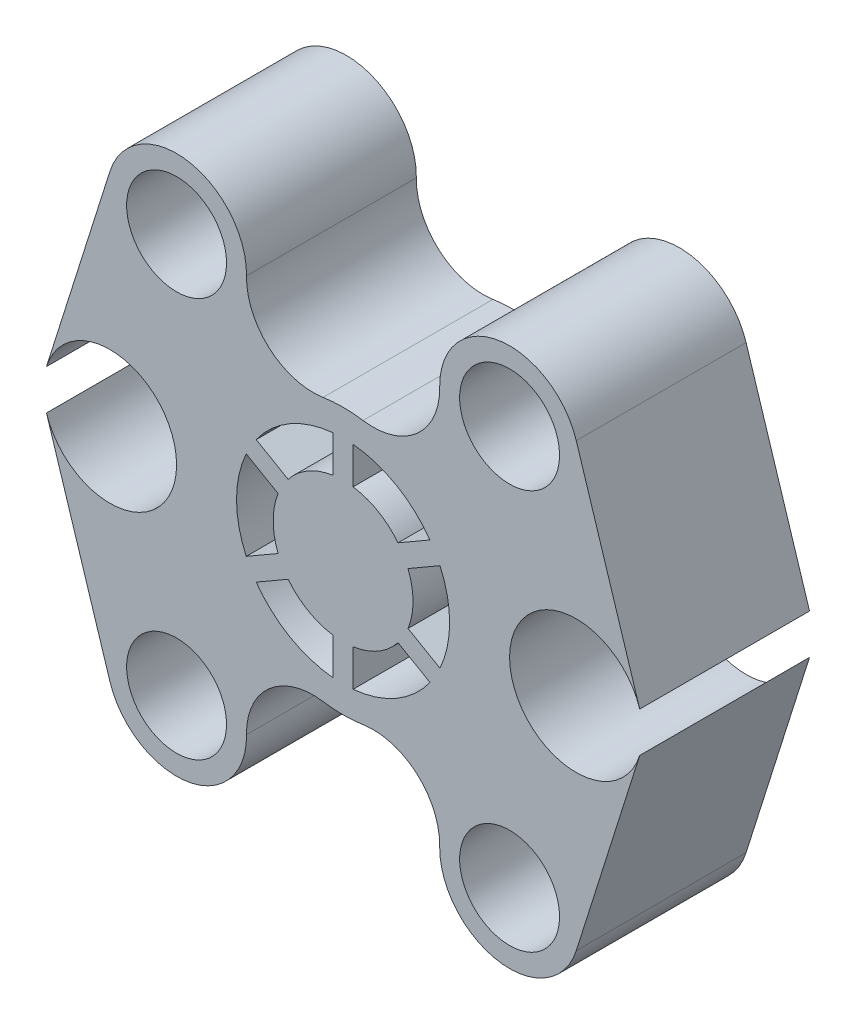
from build123d import *

# Parameters (mm, degrees)
SKETCH1_R           = 15
SKETCH1_R_2         = 40
BOSS_EXTRUDE4_DEPTH = 51


with BuildPart() as part:
    # Sketch1 → Boss-Extrude4 (new body)
    # profile 1 of 3: a face of its own
    with BuildSketch(Plane.XY):
        with BuildLine():
            ThreePointArc((-29.002885891, 59.651863383), (-46.6282273, 80.727545655), (-70.02485881, 66.324952937))
            Line((-70.02485881, 66.324952937), (-89.071294105, 6.023764702))
            ThreePointArc((-89.071294105, 6.023764702), (-66.95253237, 19.766460003), (-50, 0))
            ThreePointArc((-50, 0), (-66.95253237, -19.766460003), (-89.071294105, -6.023764702))
            Line((-89.071294105, -6.023764702), (-70.02485881, -66.324952937))
            ThreePointArc((-70.02485881, -66.324952937), (-46.6282273, -80.727545655), (-29.002885891, -59.651863383))
            ThreePointArc((-29.002885891, -59.651863383), (-22.168588856, -44.262528341), (-6.003756239, -39.546869801))
            ThreePointArc((-6.003756239, -39.546869801), (-40, 0), (-6.003756239, 39.546869801))
            ThreePointArc((-6.003756239, 39.546869801), (-22.168588856, 44.262528341), (-29.002885891, 59.651863383))
        make_face()
        with Locations((-50, -60)):
            Circle(SKETCH1_R, mode=Mode.SUBTRACT)
        with Locations((-50, 60)):
            Circle(SKETCH1_R, mode=Mode.SUBTRACT)
    # profile 2 of 3: a face of its own
    with BuildSketch(Plane.XY):
        with BuildLine():
            ThreePointArc((29.002885891, 59.651863383), (22.168588856, 44.262528341), (6.003756239, 39.546869801))
            ThreePointArc((6.003756239, 39.546869801), (30.332740146, 26.075369129), (40, 0))
            ThreePointArc((40, 0), (30.332740146, -26.075369129), (6.003756239, -39.546869801))
            ThreePointArc((6.003756239, -39.546869801), (22.168588856, -44.262528341), (29.002885891, -59.651863383))
            ThreePointArc((29.002885891, -59.651863383), (46.6282273, -80.727545655), (70.02485881, -66.324952937))
            Line((70.02485881, -66.324952937), (89.071294105, -6.023764702))
            ThreePointArc((89.071294105, -6.023764702), (50, 0), (89.071294105, 6.023764702))
            Line((89.071294105, 6.023764702), (70.02485881, 66.324952937))
            ThreePointArc((70.02485881, 66.324952937), (46.6282273, 80.727545655), (29.002885891, 59.651863383))
        make_face()
        with Locations((50, -60)):
            Circle(SKETCH1_R, mode=Mode.SUBTRACT)
        with Locations((50, 60)):
            Circle(SKETCH1_R, mode=Mode.SUBTRACT)
    # profile 3 of 3: a face of its own
    with BuildSketch(Plane.XY):
        Circle(SKETCH1_R_2)
        with BuildLine():
            ThreePointArc((26.090759323, 18.527608533), (16, 27.712812921), (3, 31.859064644))
            Line((3, 31.859064644), (3, 20.784609691))
            ThreePointArc((3, 20.784609691), (10.5, 18.186533479), (16.5, 12.990381057))
            Line((16.5, 12.990381057), (26.090759323, 18.527608533))
        make_face(mode=Mode.SUBTRACT)
        with BuildLine():
            Line((3, -20.784609691), (3, -31.859064644))
            ThreePointArc((3, -31.859064644), (16, -27.712812921), (26.090759323, -18.527608533))
            Line((26.090759323, -18.527608533), (16.5, -12.990381057))
            ThreePointArc((16.5, -12.990381057), (10.5, -18.186533479), (3, -20.784609691))
        make_face(mode=Mode.SUBTRACT)
        with BuildLine():
            Line((19.5, -7.794228634), (29.090759323, -13.331456111))
            ThreePointArc((29.090759323, -13.331456111), (32, 0), (29.090759323, 13.331456111))
            Line((29.090759323, 13.331456111), (19.5, 7.794228634))
            ThreePointArc((19.5, 7.794228634), (21, 0), (19.5, -7.794228634))
        make_face(mode=Mode.SUBTRACT)
        with BuildLine():
            Line((-3, 20.784609691), (-3, 31.859064644))
            ThreePointArc((-3, 31.859064644), (-16, 27.712812921), (-26.090759323, 18.527608533))
            Line((-26.090759323, 18.527608533), (-16.5, 12.990381057))
            ThreePointArc((-16.5, 12.990381057), (-10.5, 18.186533479), (-3, 20.784609691))
        make_face(mode=Mode.SUBTRACT)
        with BuildLine():
            Line((-19.5, 7.794228634), (-29.090759323, 13.331456111))
            ThreePointArc((-29.090759323, 13.331456111), (-32, 0), (-29.090759323, -13.331456111))
            Line((-29.090759323, -13.331456111), (-19.5, -7.794228634))
            ThreePointArc((-19.5, -7.794228634), (-21, 0), (-19.5, 7.794228634))
        make_face(mode=Mode.SUBTRACT)
        with BuildLine():
            Line((-16.5, -12.990381057), (-26.090759323, -18.527608533))
            ThreePointArc((-26.090759323, -18.527608533), (-16, -27.712812921), (-3, -31.859064644))
            Line((-3, -31.859064644), (-3, -20.784609691))
            ThreePointArc((-3, -20.784609691), (-10.5, -18.186533479), (-16.5, -12.990381057))
        make_face(mode=Mode.SUBTRACT)
    extrude(amount=BOSS_EXTRUDE4_DEPTH)


solid = part.part
